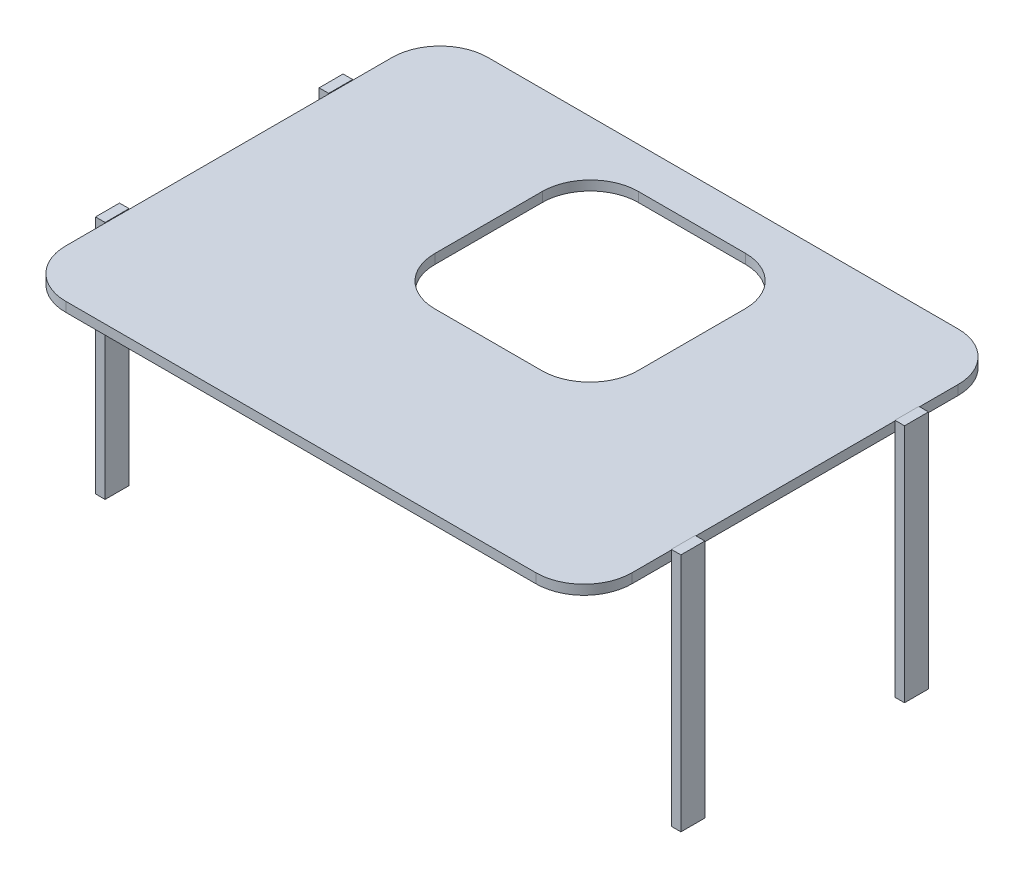
from build123d import *

# Parameters (mm, degrees)
ESBO_O1_W                = 118
ESBO_O1_H                = 88
RESSALTO_EXTRUS_O1_DEPTH = 2
FILETE1_R                = 10
FILETE2_R                = 10
ESBO_O2_W                = 42.31
ESBO_O2_H                = 42.4
CORTE_EXTRUS_O2_DEPTH    = 2
FILETE3_R                = 10
ESBO_O5_W                = 5
ESBO_O5_H                = 50
RESSALTO_EXTRUS_O3_DEPTH = 2
RESSALTO_EXTRUS_O4_START = -10
ESBO_O6_W                = 5
ESBO_O6_H                = 50
RESSALTO_EXTRUS_O4_DEPTH = 2


with BuildPart() as part:
    # Esboço1 → Ressalto-extrusão1 (new body)
    with BuildSketch(Plane(origin=(0, 0, 0), x_dir=(1, 0, 0), z_dir=(0, 1, 0))):
        Rectangle(ESBO_O1_W, ESBO_O1_H)
    extrude(amount=RESSALTO_EXTRUS_O1_DEPTH)

    # Filete1
    filete1_edges = [part.edges().sort_by_distance(p)[0] for p in [
        (59, 1, -44),
    ]]
    fillet(filete1_edges, radius=FILETE1_R)

    # Filete2
    filete2_edges = [part.edges().sort_by_distance(p)[0] for p in [
        (59, 1, 44),
        (-59, 1, 44),
        (-59, 1, -44),
    ]]
    fillet(filete2_edges, radius=FILETE2_R)

    # Esboço2 → Corte-extrusão2 (cut)
    with BuildSketch(Plane(origin=(0, 0, 0), x_dir=(1, 0, 0), z_dir=(0, 1, 0))):
        with Locations((1.985, 14.29)):
            Rectangle(ESBO_O2_W, ESBO_O2_H)
    extrude(amount=CORTE_EXTRUS_O2_DEPTH, mode=Mode.SUBTRACT)

    # Filete3
    filete3_edges = [part.edges().sort_by_distance(p)[0] for p in [
        (-19.17, 1, -35.49),
        (-19.17, 1, 6.91),
        (23.14, 1, 6.91),
        (23.14, 1, -35.49),
    ]]
    fillet(filete3_edges, radius=FILETE3_R)

    # Esboço5 → Ressalto-extrusão3 (add)
    with BuildSketch(Plane(origin=(59, 0, 0), x_dir=(0, 0, -1), z_dir=(1, 0, 0))):
        with Locations((-23.3, -22.870840319)):
            Rectangle(ESBO_O5_W, ESBO_O5_H)
        with Locations((23.3, -22.870840319)):
            Rectangle(ESBO_O5_W, ESBO_O5_H)
    extrude(amount=RESSALTO_EXTRUS_O3_DEPTH)

    # Esboço6 → Ressalto-extrusão4 (add)
    with BuildSketch(Plane.ZY.offset(69).offset(RESSALTO_EXTRUS_O4_START)):
        with Locations((-23.3, -22.870840319)):
            Rectangle(ESBO_O6_W, ESBO_O6_H)
        with Locations((23.3, -22.870840319)):
            Rectangle(ESBO_O6_W, ESBO_O6_H)
    extrude(amount=RESSALTO_EXTRUS_O4_DEPTH)


solid = part.part
